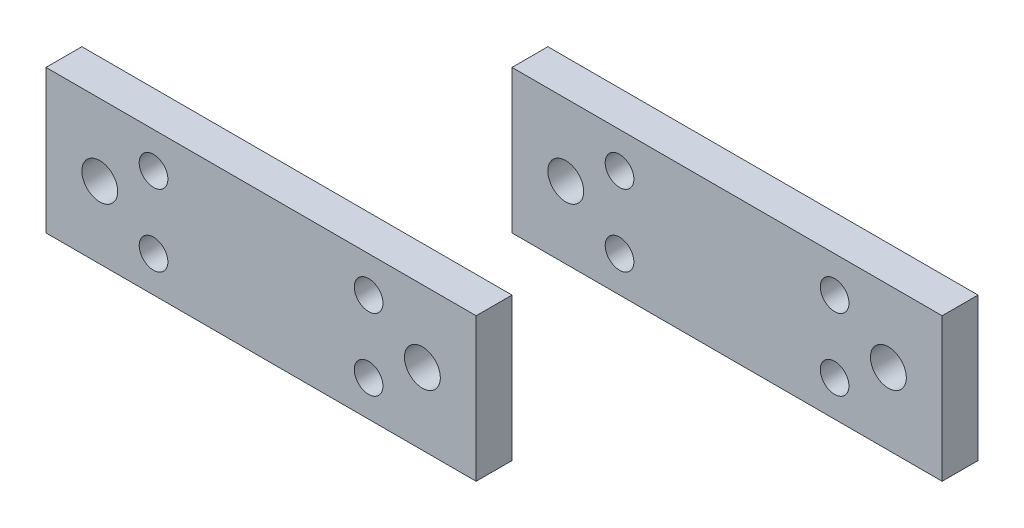
from build123d import *

# Parameters (mm, degrees)
SKETCH1_W             = 24
SKETCH1_H             = 8
SKETCH1_R             = 1
SKETCH1_R_2           = 0.8
BOSS_EXTRUDE1_DEPTH   = 2
BOSS_EXTRUDE1_2_DEPTH = 2


with BuildPart() as part:
    # Sketch1 → Boss-Extrude1 (new body)
    with BuildSketch(Plane.XY):
        with Locations((-8.500045519, -6.479626746)):
            Rectangle(SKETCH1_W, SKETCH1_H)
        with Locations(Location((0.499954481, -6.479626746, 0), (0, 0, 180))):
            Circle(SKETCH1_R, mode=Mode.SUBTRACT)
        with Locations((-14.500045519, -4.479626746)):
            Circle(SKETCH1_R_2, mode=Mode.SUBTRACT)
        with Locations((-2.500045519, -8.479626746)):
            Circle(SKETCH1_R_2, mode=Mode.SUBTRACT)
        with Locations(Location((-2.500045519, -4.479626746, 0), (0, 0, 180))):
            Circle(SKETCH1_R_2, mode=Mode.SUBTRACT)
        with Locations((-17.500045519, -6.479626746)):
            Circle(SKETCH1_R, mode=Mode.SUBTRACT)
        with Locations(Location((-14.500045519, -8.479626746, 0), (0, 0, 180))):
            Circle(SKETCH1_R_2, mode=Mode.SUBTRACT)
    extrude(amount=BOSS_EXTRUDE1_DEPTH)


with BuildPart() as body_2:
    # Sketch1 → Boss-Extrude1 2 (new body)
    with BuildSketch(Plane.XY):
        with Locations((17.499954481, 6.520373254)):
            Rectangle(SKETCH1_W, SKETCH1_H)
        with Locations((11.499954481, 8.520373254)):
            Circle(SKETCH1_R_2, mode=Mode.SUBTRACT)
        with Locations((8.499954481, 6.520373254)):
            Circle(SKETCH1_R, mode=Mode.SUBTRACT)
        with Locations(Location((11.499954481, 4.520373254, 0), (0, 0, 180))):
            Circle(SKETCH1_R_2, mode=Mode.SUBTRACT)
        with Locations((23.499954481, 4.520373254)):
            Circle(SKETCH1_R_2, mode=Mode.SUBTRACT)
        with Locations(Location((26.499954481, 6.520373254, 0), (0, 0, 180))):
            Circle(SKETCH1_R, mode=Mode.SUBTRACT)
        with Locations(Location((23.499954481, 8.520373254, 0), (0, 0, 180))):
            Circle(SKETCH1_R_2, mode=Mode.SUBTRACT)
    extrude(amount=BOSS_EXTRUDE1_2_DEPTH)


solid = Compound([part.part, body_2.part])
